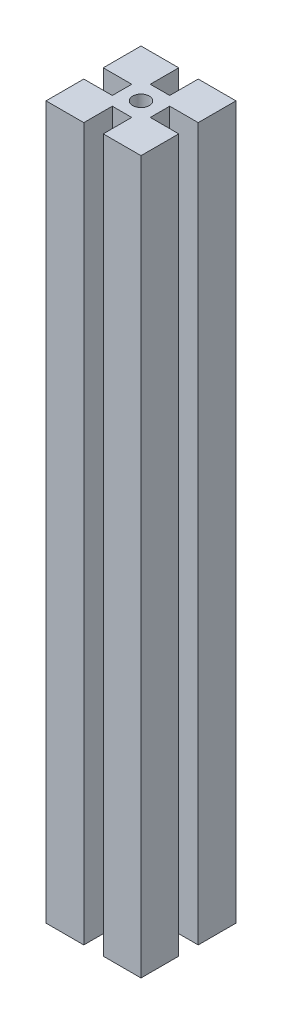
from build123d import *

# Parameters (mm, degrees)
SKIZZE1_R                       = 3.5
AUFSATZ_LINEAR_AUSTRAGEN1_DEPTH = 300


with BuildPart() as part:
    # Skizze1 → Aufsatz-Linear austragen1 (new body)
    with BuildSketch(Plane(origin=(0, 0, 0), x_dir=(1, 0, 0), z_dir=(0, 1, 0))):
        Polygon((-4.1, -20), (-4.1, -8), (4.1, -8), (4.1, -20), (20, -20), (20, -4.1), (8, -4.1), (8, 4.1), (20, 4.1), (20, 20), (4.1, 20), (4.1, 8), (-4.1, 8), (-4.1, 20), (-20, 20), (-20, 4.1), (-8, 4.1), (-8, -4.1), (-20, -4.1), (-20, -20), align=None)
        with Locations(Location((0, 0, 0), (0, 0, 270))):
            Circle(SKIZZE1_R, mode=Mode.SUBTRACT)
    extrude(amount=AUFSATZ_LINEAR_AUSTRAGEN1_DEPTH)


solid = part.part
